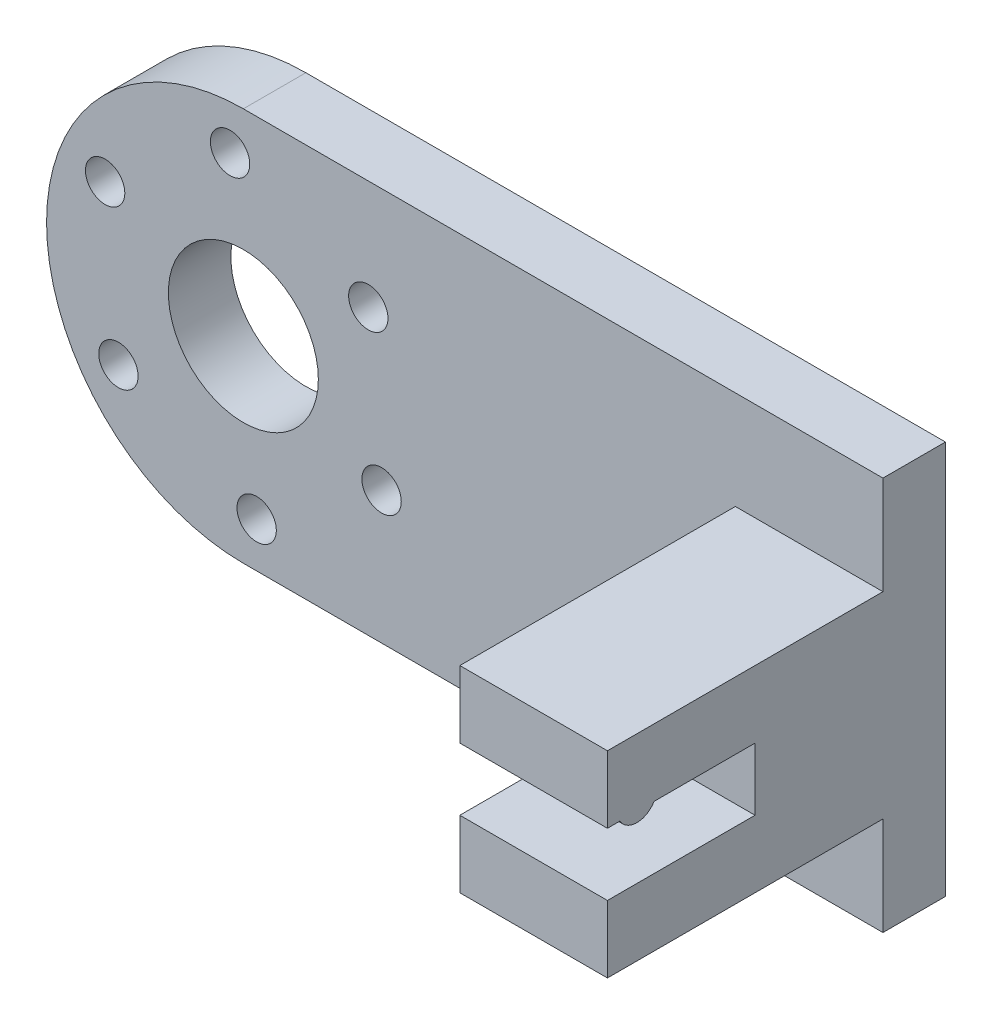
from build123d import *

# Parameters (mm, degrees)
SKETCH1_R           = 20
SKETCH1_W           = 65
SKETCH1_H           = 40
BOSS_EXTRUDE1_DEPTH = 6.35
SKETCH2_R           = 7.62
SKETCH2_R_2         = 2
CUT_EXTRUDE1_DEPTH  = 69.303166105
SKETCH4_W           = 15
SKETCH4_H           = 28
BOSS_EXTRUDE2_DEPTH = 10
CUT_EXTRUDE2_REACH  = 95.835
SKETCH5_W           = 15
SKETCH5_H           = 6.35
CUT_EXTRUDE3_REACH  = 78.19
SKETCH7_R           = 17.5
SKETCH7_R_2         = 13.5
CUT_EXTRUDE4_DEPTH  = 2
SKETCH8_R           = 2
BOSS_EXTRUDE3_DEPTH = 15


with BuildPart() as part:
    # Sketch1 → Boss-Extrude1 (new body)
    with BuildSketch(Plane.XY):
        Circle(SKETCH1_R)
        with Locations((32.5, 0)):
            Rectangle(SKETCH1_W, SKETCH1_H)
    extrude(amount=BOSS_EXTRUDE1_DEPTH)

    # Sketch2 → Cut-Extrude1 (cut, through all)
    with BuildSketch(Plane.XY.offset(6.35)):
        Circle(SKETCH2_R)
        with Locations((-1.350914013, 15.44101782)):
            Circle(SKETCH2_R_2)
        with Locations((12.696856686, 8.890434763)):
            Circle(SKETCH2_R_2)
        with Locations((14.047770699, -6.550583057)):
            Circle(SKETCH2_R_2)
        with Locations((1.350914013, -15.44101782)):
            Circle(SKETCH2_R_2)
        with Locations((-12.696856686, -8.890434763)):
            Circle(SKETCH2_R_2)
        with Locations((-14.047770699, 6.550583057)):
            Circle(SKETCH2_R_2)
    extrude(amount=-CUT_EXTRUDE1_DEPTH, mode=Mode.SUBTRACT)

    # Sketch4 → Boss-Extrude2 (add, symmetric)
    with BuildSketch(Plane(origin=(0, 0, 0), x_dir=(1, 0, 0), z_dir=(0, 1, 0))):
        with Locations((57.5, -20.35)):
            Rectangle(SKETCH4_W, SKETCH4_H)
    extrude(amount=BOSS_EXTRUDE2_DEPTH, both=True)

    # Sketch5 → Cut-Extrude2 (cut, up to next)
    with BuildSketch(Plane(origin=(65, 0, 0), x_dir=(0, 0, -1), z_dir=(1, 0, 0)), mode=Mode.PRIVATE) as cut_extrude2_sk1:
        with Locations((-26.85, 0)):
            Rectangle(SKETCH5_W, SKETCH5_H)
    cut_extrude2_tool1 = extrude(cut_extrude2_sk1.sketch, amount=-CUT_EXTRUDE2_REACH, mode=Mode.PRIVATE) & part.part
    add(cut_extrude2_tool1.solids().sort_by_distance((65, 0, 26.85))[0], mode=Mode.SUBTRACT)

    # Sketch6 → Cut-Extrude3 (cut, up to next)
    with BuildSketch(Plane(origin=(0, 0, 0), x_dir=(-1, 0, 0), z_dir=(0, 0, -1)), mode=Mode.PRIVATE) as cut_extrude3_sk1:
        with BuildLine():
            Line((-47.393320053, 2.55), (-44.046679947, 2.55))
            ThreePointArc((-44.046679947, 2.55), (-45.72, -3.05), (-47.393320053, 2.55))
        make_face()
    cut_extrude3_tool1 = extrude(cut_extrude3_sk1.sketch, amount=-CUT_EXTRUDE3_REACH, mode=Mode.PRIVATE) & part.part
    add(cut_extrude3_tool1.solids().sort_by_distance((45.72, -0.111199, 0))[0], mode=Mode.SUBTRACT)

    # Sketch7 → Cut-Extrude4 (cut)
    with BuildSketch(Plane(origin=(0, 0, 0), x_dir=(-1, 0, 0), z_dir=(0, 0, -1))):
        with Locations((-45.72, 0)):
            Circle(SKETCH7_R)
        with Locations((-45.72, 0)):
            Circle(SKETCH7_R_2, mode=Mode.SUBTRACT)
    extrude(amount=-CUT_EXTRUDE4_DEPTH, mode=Mode.SUBTRACT)

    # Sketch8 → Boss-Extrude3 (add)
    with BuildSketch(Plane(origin=(65, 0, 0), x_dir=(0, 0, -1), z_dir=(1, 0, 0))):
        with Locations((-31.35, 4.175)):
            Circle(SKETCH8_R)
    extrude(amount=-BOSS_EXTRUDE3_DEPTH)


solid = part.part
